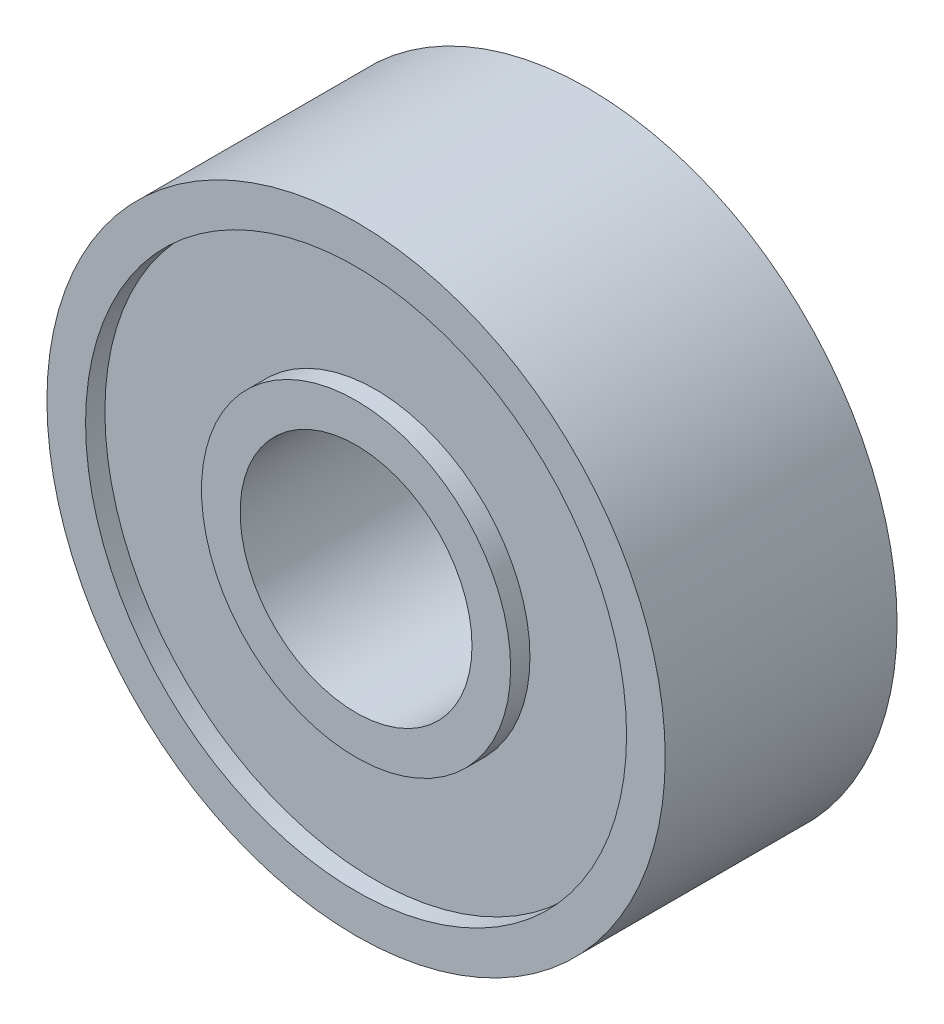
from build123d import *

# Parameters (mm, degrees)
SKETCH1_R           = 8
SKETCH1_R_2         = 3
BOSS_EXTRUDE1_DEPTH = 3
SKETCH2_R           = 7
SKETCH2_R_2         = 4
CUT_EXTRUDE1_DEPTH  = 0.5


with BuildPart() as part:
    # Sketch1 → Boss-Extrude1 (new, symmetric)
    with BuildSketch(Plane.XY):
        Circle(SKETCH1_R)
        Circle(SKETCH1_R_2, mode=Mode.SUBTRACT)
    extrude(amount=BOSS_EXTRUDE1_DEPTH, both=True)

    # Sketch2 → Cut-Extrude1 (cut)
    with BuildSketch(Plane.XY.offset(3)):
        Circle(SKETCH2_R)
        Circle(SKETCH2_R_2, mode=Mode.SUBTRACT)
    cut_extrude1 = extrude(amount=-CUT_EXTRUDE1_DEPTH, mode=Mode.SUBTRACT)

    # Mirror1: Cut-Extrude1 across plane
    add(cut_extrude1.mirror(Plane.XY), mode=Mode.SUBTRACT)


solid = part.part
